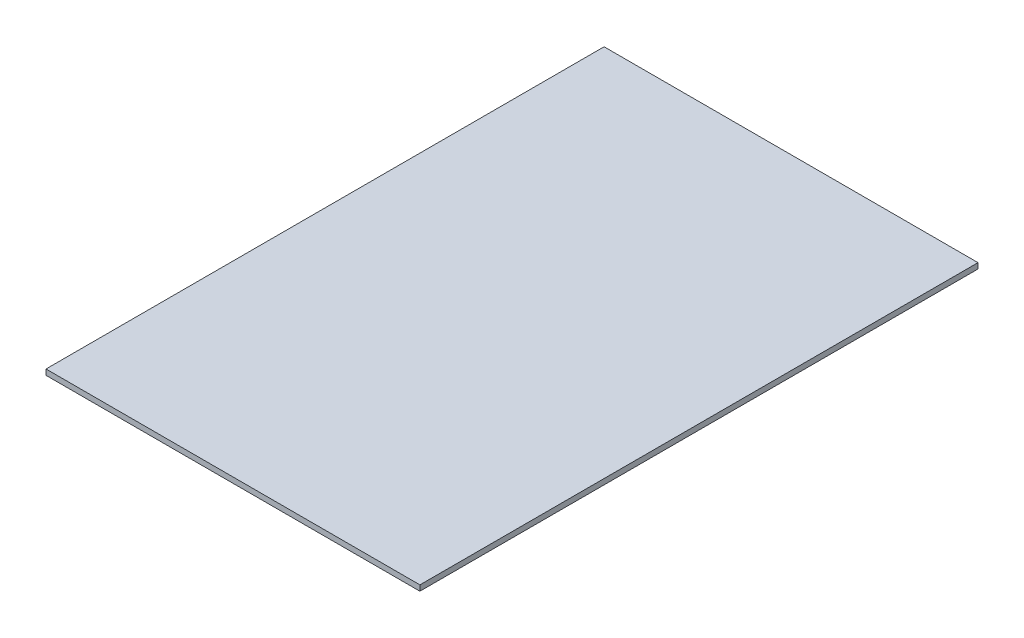
from build123d import *

# Parameters (mm, degrees)
SKETCH_1_W      = 203
SKETCH_1_H      = 303
EXTRUDE_1_DEPTH = 3


with BuildPart() as part:
    # 草图1 → 凸台-拉伸1 (new body)
    with BuildSketch(Plane(origin=(0, 0, 0), x_dir=(1, 0, 0), z_dir=(0, 1, 0))):
        Rectangle(SKETCH_1_W, SKETCH_1_H)
    extrude(amount=EXTRUDE_1_DEPTH)


solid = part.part
